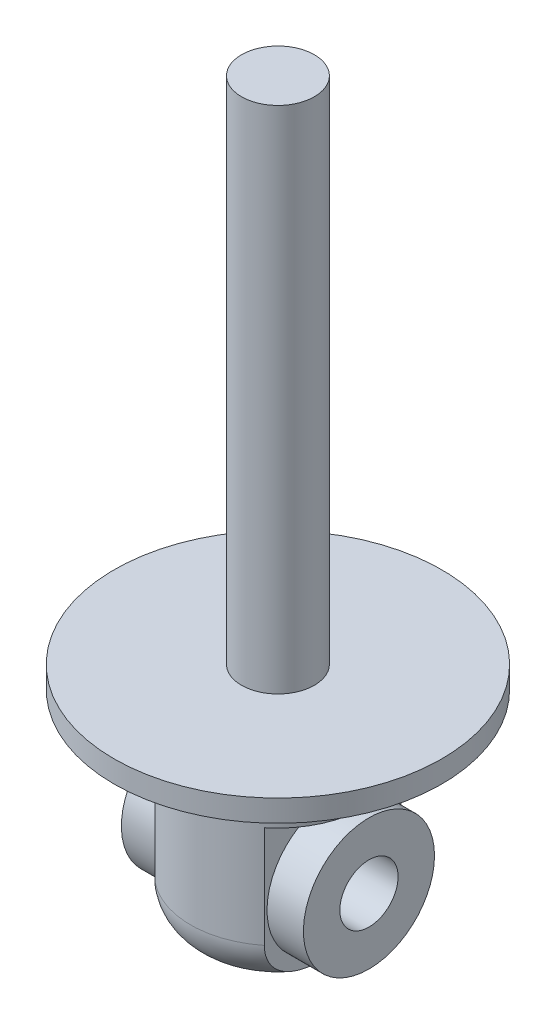
from build123d import *
from build123d.topology import SkipClean

# Parameters (mm, degrees)
SKETCH1_R               = 22.5
BOSS_EXTRUDE1_DEPTH     = 3
SKETCH3_R               = 5
BOSS_EXTRUDE2_DEPTH     = 70
SKETCH4_R               = 12
BOSS_EXTRUDE3_DEPTH     = 28
FILLET1_R               = 6
CUT_EXTRUDE1_DEPTH      = 80.633535649
CUT_EXTRUDE1_DEPTH_BACK = 80.633535649
SKETCH5_W               = 19.57
SKETCH5_H               = 20
SKETCH8_R               = 4
CUT_EXTRUDE3_DEPTH      = 28
SKETCH10_R              = 9
SKETCH10_R_2            = 4
BOSS_EXTRUDE4_DEPTH     = 12.5


with BuildPart() as part:
    # Sketch1 → Boss-Extrude1 (new body)
    with BuildSketch(Plane(origin=(0, 0, 0), x_dir=(1, 0, 0), z_dir=(0, 1, 0))):
        with Locations(Location((0, 0, 0), (0, 0, 270))):
            Circle(SKETCH1_R)
    extrude(amount=BOSS_EXTRUDE1_DEPTH)

    # Sketch3 → Boss-Extrude2 (add)
    with BuildSketch(Plane(origin=(0, 3, 0), x_dir=(1, 0, 0), z_dir=(0, 1, 0))):
        with Locations(Location((0, 0, 0), (0, 0, 270))):
            Circle(SKETCH3_R)
    extrude(amount=BOSS_EXTRUDE2_DEPTH)

    # Sketch4 → Boss-Extrude3 (add)
    with BuildSketch(Plane.XZ):
        with Locations(Location((0, 0, 0), (0, 0, 270))):
            Circle(SKETCH4_R)
    extrude(amount=BOSS_EXTRUDE3_DEPTH)

    # Fillet1
    fillet1_edges = [part.edges().sort_by_distance(p)[0] for p in [
        (0, -28, 12),
    ]]
    fillet(fillet1_edges, radius=FILLET1_R)

    # Sketch5 → Cut-Extrude1 (cut, two sides: drawn at the far end of the back side and taken through both)
    with BuildSketch(Plane.XY.offset(-CUT_EXTRUDE1_DEPTH_BACK)):
        with Locations((17.285, -18)):
            Rectangle(SKETCH5_W, SKETCH5_H)
        with Locations((-17.285, -18)):
            Rectangle(SKETCH5_W, SKETCH5_H)
    extrude(amount=CUT_EXTRUDE1_DEPTH + CUT_EXTRUDE1_DEPTH_BACK, mode=Mode.SUBTRACT)

    # Sketch8 → Cut-Extrude3 (cut)
    with BuildSketch(Plane(origin=(7.5, 0, 0), x_dir=(0, 0, -1), z_dir=(1, 0, 0))):
        with Locations(Location((0, -18, 0), (0, 0, 90))):
            Circle(SKETCH8_R)
    extrude(amount=-CUT_EXTRUDE3_DEPTH, mode=Mode.SUBTRACT)

    # Sketch10 → Boss-Extrude4 (add, symmetric)
    with SkipClean():  # the faces are left unmerged after this step: merging them gives an invalid solid
        with BuildSketch(Plane(origin=(0, 0, 0), x_dir=(0, 0, -1), z_dir=(1, 0, 0))):
            with Locations(Location((0, -18, 0), (0, 0, 270))):
                Circle(SKETCH10_R)
            with Locations((0, -18)):
                Circle(SKETCH10_R_2, mode=Mode.SUBTRACT)
        extrude(amount=BOSS_EXTRUDE4_DEPTH, both=True)


solid = part.part
